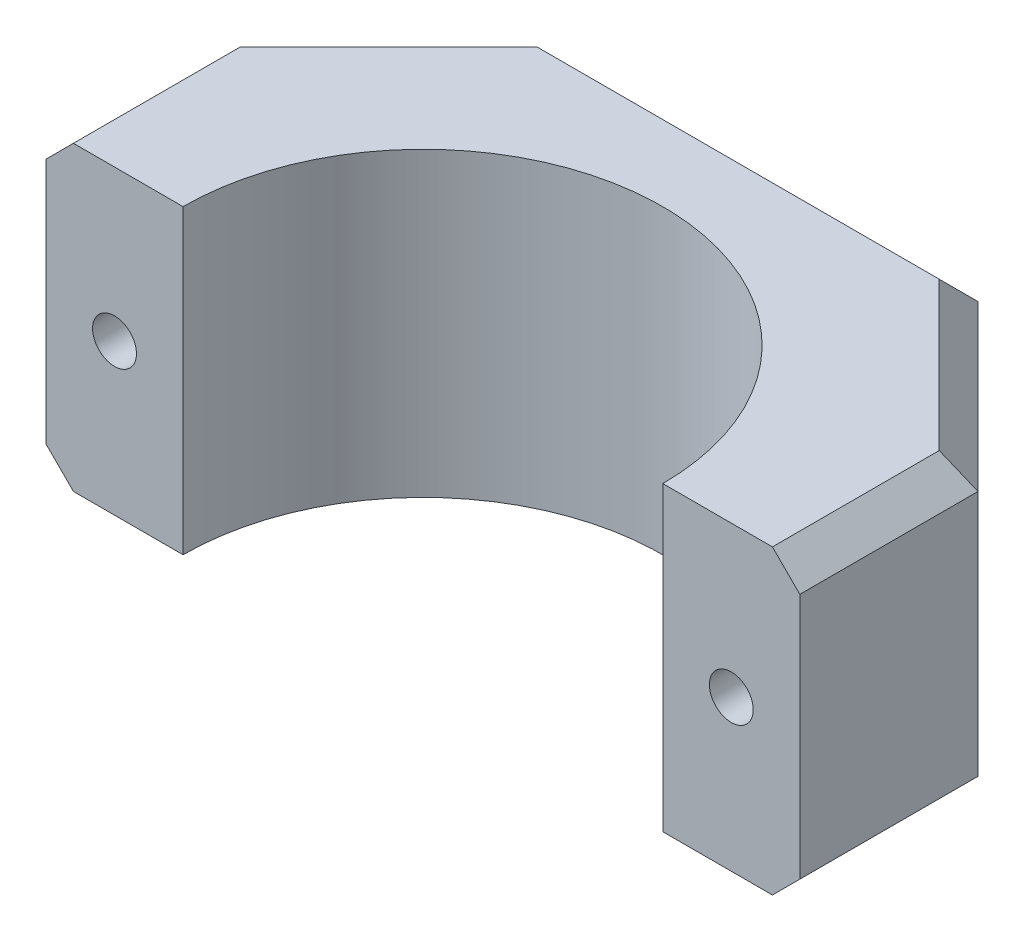
from build123d import *

# Parameters (mm, degrees)
BOSS_EXTRUDE1_DEPTH = 22
CHAMFER1_SIZE       = 12
SKETCH2_R           = 1.6
CUT_EXTRUDE1_DEPTH  = 25
SKETCH2_4_R         = 3
SKETCH2_4_R_2       = 1.6
CUT_EXTRUDE2_DEPTH  = 21
CHAMFER2_SIZE       = 2


with BuildPart() as part:
    # Sketch1 → Boss-Extrude1 (new body)
    with BuildSketch(Plane(origin=(0, 0, 0), x_dir=(1, 0, 0), z_dir=(0, 1, 0))):
        with BuildLine():
            Line((-38.985549133, -2.028901734), (-48.985549133, -2.028901734))
            Line((-48.985549133, -2.028901734), (-48.985549133, 22.971098266))
            Line((-48.985549133, 22.971098266), (6.014450867, 22.971098266))
            Line((6.014450867, 22.971098266), (6.014450867, -2.028901734))
            Line((6.014450867, -2.028901734), (-3.985549133, -2.028901734))
            ThreePointArc((-3.985549133, -2.028901734), (-21.485549133, 15.471098266), (-38.985549133, -2.028901734))
        make_face()
    extrude(amount=BOSS_EXTRUDE1_DEPTH)

    # Chamfer1
    chamfer1_edges = [part.edges().sort_by_distance(p)[0] for p in [
        (-48.985549133, 11, -22.971098266),
        (6.014450867, 11, -22.971098266),
    ]]
    chamfer(chamfer1_edges, length=CHAMFER1_SIZE)

    # Sketch2 → Cut-Extrude1 (cut)
    with BuildSketch(Plane(origin=(0, 0, -22.971098266), x_dir=(-1, 0, 0), z_dir=(0, 0, -1))):
        with Locations((43.985549133, 11)):
            Circle(SKETCH2_R)
        with Locations((-1.014450867, 11)):
            Circle(SKETCH2_R)
    extrude(amount=-CUT_EXTRUDE1_DEPTH, mode=Mode.SUBTRACT)

    # Sketch2<4> → Cut-Extrude2 (cut)
    # profile 1 of 2: a face of its own
    with BuildSketch(Plane(origin=(0, 0, -22.971098266), x_dir=(-1, 0, 0), z_dir=(0, 0, -1))):
        with Locations((43.985549133, 11)):
            Circle(SKETCH2_4_R)
        with Locations((43.985549133, 11)):
            Circle(SKETCH2_4_R_2, mode=Mode.SUBTRACT)
    # profile 2 of 2: a face of its own
    with BuildSketch(Plane(origin=(0, 0, -22.971098266), x_dir=(-1, 0, 0), z_dir=(0, 0, -1))):
        with Locations((-1.014450867, 11)):
            Circle(SKETCH2_4_R)
        with Locations((-1.014450867, 11)):
            Circle(SKETCH2_4_R_2, mode=Mode.SUBTRACT)
    extrude(amount=-CUT_EXTRUDE2_DEPTH, mode=Mode.SUBTRACT)

    # Chamfer2
    chamfer2_edges = [part.edges().sort_by_distance(p)[0] for p in [
        (6.014450867, 22, -4.471098266),
        (-21.485549133, 0, -22.971098266),
        (-21.485549133, 22, -22.971098266),
        (-48.985549133, 0, -4.471098266),
        (-42.985549133, 0, -16.971098266),
        (0.014450867, 0, -16.971098266),
        (-48.985549133, 22, -4.471098266),
        (-42.985549133, 22, -16.971098266),
        (0.014450867, 22, -16.971098266),
        (6.014450867, 0, -4.471098266),
    ]]
    chamfer(chamfer2_edges, length=CHAMFER2_SIZE)


solid = part.part
